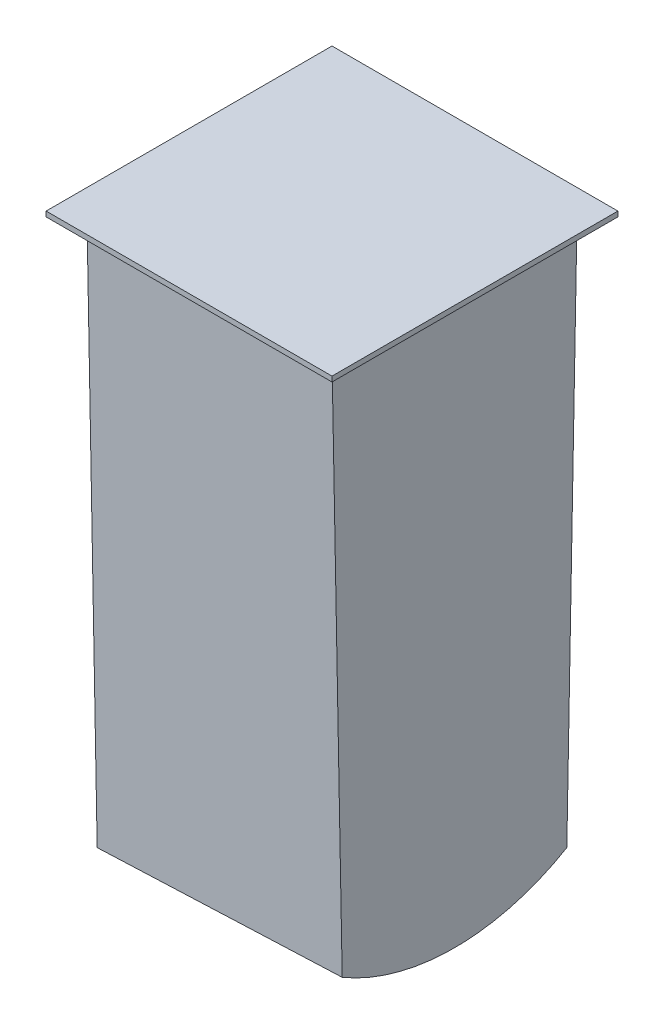
from build123d import *

# Parameters (mm, degrees)
SKETCH9_W = 355.6
SKETCH9_H = 355.6
LID_DEPTH = 6.35


with BuildPart() as part:
    # Tall side for Body → Body section 0
    with BuildSketch(Plane(origin=(0, 0, 0), x_dir=(0, 0, -1), z_dir=(1, 0, 0))):
        with BuildLine():
            Line((640.712288406, 692.644571301), (335.912288406, 692.644571301))
            Line((335.912288406, 692.644571301), (348.612288406, 6.844571301))
            # circular arc as an exact rational Bezier (weights 1, cos(half-angle), 1)
            Bezier((348.612288406, 6.844571301), (488.312288406, -110.237333461), (628.012288406, 6.844571301), weights=[1, 0.766423358, 1])
            Line((628.012288406, 6.844571301), (640.712288406, 692.644571301))
        make_face()
    # Short side for Body → Body section 1
    with BuildSketch(Plane(origin=(304.8, 0, 0), x_dir=(0, 0, -1), z_dir=(1, 0, 0))):
        with BuildLine():
            Line((640.716339838, 692.644571301), (335.916339838, 692.644571301))
            Line((335.916339838, 692.644571301), (348.616339838, 19.544571301))
            Bezier((348.616339838, 19.544571301), (488.316339838, -62.778642984), (628.016339838, 19.544571301), weights=[1, 0.861538462, 1])
            Line((628.016339838, 19.544571301), (640.716339838, 692.644571301))
        make_face()
    loft()

    # Sketch9 → Lid (add)
    with BuildSketch(Plane(origin=(0, 692.644571301, 0), x_dir=(1, 0, 0), z_dir=(0, 1, 0))):
        with Locations((152.4, 488.314314122)):
            Rectangle(SKETCH9_W, SKETCH9_H)
    extrude(amount=LID_DEPTH)


solid = part.part
